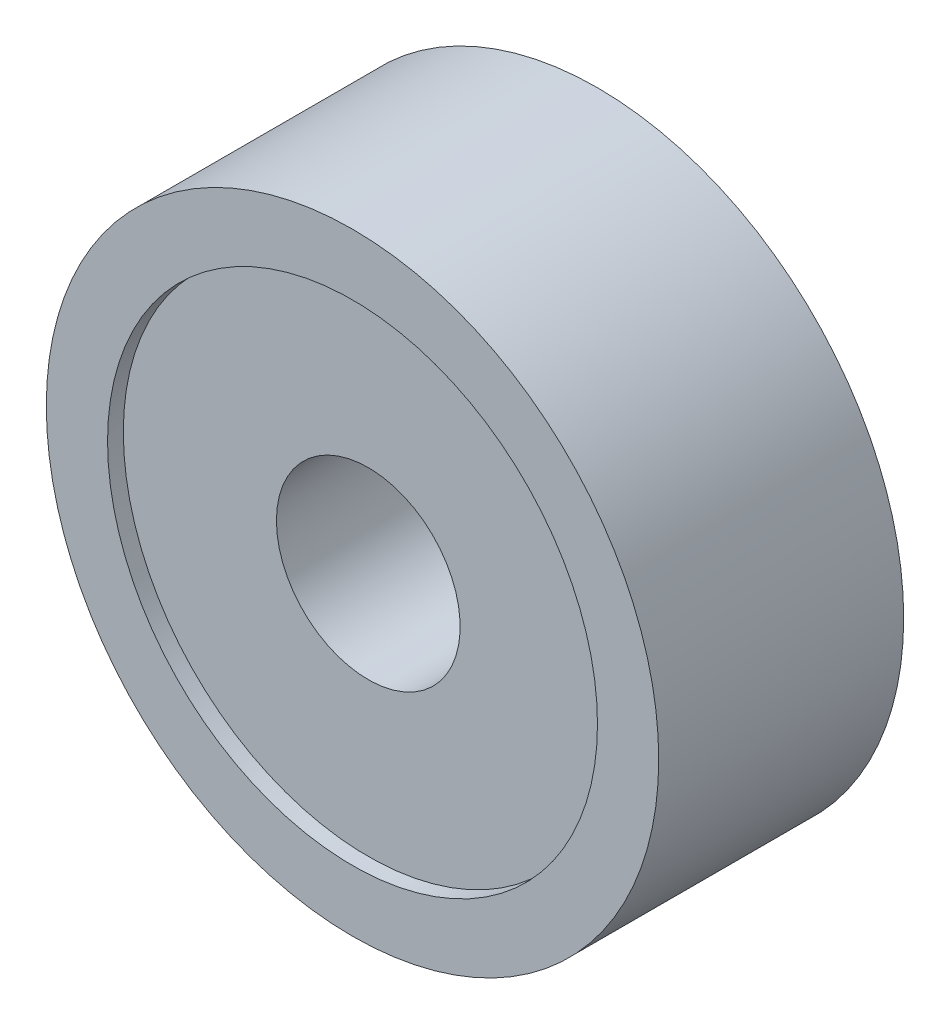
from build123d import *

# Parameters (mm, degrees)
SKETCH2_R           = 5
SKETCH2_R_2         = 1.5
BOSS_EXTRUDE1_DEPTH = 4
SKETCH3_W           = 3
SKETCH3_H           = 0.5


with BuildPart() as part:
    # Sketch2 → Boss-Extrude1 (new body)
    with BuildSketch(Plane.XY):
        Circle(SKETCH2_R)
        Circle(SKETCH2_R_2, mode=Mode.SUBTRACT)
    extrude(amount=BOSS_EXTRUDE1_DEPTH)

    # Sketch3 → Cut-Revolve1 (revolve, cut)
    with BuildSketch(Plane(origin=(0, 0, 0), x_dir=(1, 0, 0), z_dir=(0, 1, 0))):
        with Locations((-2.5, 0)):
            Rectangle(SKETCH3_W, SKETCH3_H)
        with Locations((-2.5, -3.992537494)):
            Rectangle(SKETCH3_W, SKETCH3_H)
    revolve(axis=Axis((0, 0, 0), (0, 0, 1)), mode=Mode.SUBTRACT)


solid = part.part
